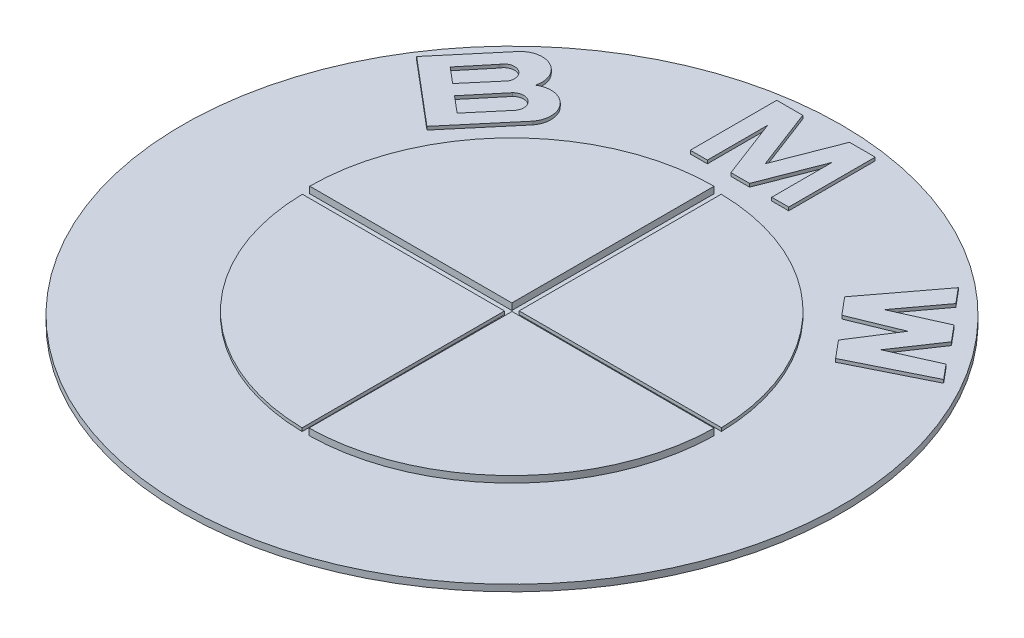
from build123d import *

# Parameters (mm, degrees)
BOSS_EXTRUDE7_DEPTH   = 4
BOSS_EXTRUDE7_2_DEPTH = 4
SKETCH2_R             = 201.031521777
BOSS_EXTRUDE7_3_DEPTH = 4
BOSS_EXTRUDE10_DEPTH  = 6
BOSS_EXTRUDE11_DEPTH  = 8


with BuildPart() as part:
    # Sketch2 → Boss-Extrude7 (new body)
    with BuildSketch(Plane(origin=(0, 0, 0), x_dir=(1, 0, 0), z_dir=(0, 1, 0))):
        with BuildLine():
            Line((-105.724699903, 89.663383086), (-119.246794828, 73.282274115))
            Line((-119.246794828, 73.282274115), (-109.765335501, 65.257065635))
            Line((-109.765335501, 65.257065635), (-94.158059223, 83.696431494))
            ThreePointArc((-94.158059223, 83.696431494), (-96.957903767, 92.46322763), (-105.724699903, 89.663383086))
        make_face()
    extrude(amount=BOSS_EXTRUDE7_DEPTH)



with BuildPart() as body_2:
    # Sketch2 → Boss-Extrude7 2 (new body)
    with BuildSketch(Plane(origin=(0, 0, 0), x_dir=(1, 0, 0), z_dir=(0, 1, 0))):
        with BuildLine():
            Line((-86.720953962, 78.679511972), (-102.73694564, 59.398841753))
            Line((-102.73694564, 59.398841753), (-92.743706606, 50.992764213))
            Line((-92.743706606, 50.992764213), (-76.304147471, 70.536296052))
            ThreePointArc((-76.304147471, 70.536296052), (-77.810994424, 79.342936952), (-86.720953962, 78.679511972))
        make_face()
    extrude(amount=BOSS_EXTRUDE7_2_DEPTH)


with BuildPart() as body_3:
    # Sketch2 → Boss-Extrude7 3 (new body)
    with BuildSketch(Plane(origin=(0, 0, 0), x_dir=(1, 0, 0), z_dir=(0, 1, 0))):
        with Locations((28.728301923, -36.999075156)):
            Circle(SKETCH2_R)
        with BuildLine():
            Line((26.186120795, -39.0255328), (26.186120795, -162.512993196))
            ThreePointArc((26.186120795, -162.512993196), (-60.428579099, -125.690271204), (-97.133377287, -39.0255328))
            Line((-97.133377287, -39.0255328), (26.186120795, -39.0255328))
        make_face(mode=Mode.SUBTRACT)
        with BuildLine():
            ThreePointArc((154.049264899, -39.0255328), (117.2962644, -125.8779667), (30.394002326, -162.512993196))
            Line((30.394002326, -162.512993196), (30.778576004, -39.0255328))
            Line((30.778576004, -39.0255328), (154.049264899, -39.0255328))
        make_face(mode=Mode.SUBTRACT)
        with BuildLine():
            Line((26.186120795, -34.547580598), (-97.133377287, -34.521676642))
            ThreePointArc((-97.133377287, -34.521676642), (-60.995615689, 52.670789611), (26.21202475, 88.771917484))
            Line((26.21202475, 88.771917484), (26.186120795, -34.547580598))
        make_face(mode=Mode.SUBTRACT)
        with BuildLine():
            Line((-94.990225375, 34.841498226), (-135.009946729, 68.585928646))
            Line((-135.009946729, 68.585928646), (-106.417778138, 102.547819155))
            ThreePointArc((-106.417778138, 102.547819155), (-90.003173195, 105.01895685), (-83.698244067, 89.663383086))
            ThreePointArc((-83.698244067, 89.663383086), (-66.285464204, 87.446031309), (-65.417157073, 69.914129125))
            Line((-65.417157073, 69.914129125), (-94.990225375, 34.841498226))
        make_face(mode=Mode.SUBTRACT)
        Polygon((8.355015654, 102.547819155), (-2.065397597, 102.547819155), (-2.065397597, 155.293154737), (13.798357886, 155.293154737), (27.918843536, 118.248670779), (42.300819661, 155.293154737), (57.990248161, 155.293154737), (57.990248161, 102.547819155), (47.617792653, 102.547819155), (47.617792653, 139.342235762), (33.550995269, 103.109575833), (22.166053086, 103.109575833), (8.355015654, 139.342235762), align=None, mode=Mode.SUBTRACT)
        with BuildLine():
            ThreePointArc((30.605293957, 88.771917484), (117.203738276, 52.031920201), (154.049264899, -34.521676642))
            Line((154.049264899, -34.521676642), (30.605293957, -34.521676642))
            Line((30.605293957, -34.521676642), (30.605293957, 88.771917484))
        make_face(mode=Mode.SUBTRACT)
        Polygon((131.33927946, 61.588463956), (122.465283041, 72.187959679), (152.283015919, 111.685620156), (159.93326792, 102.547819155), (141.369313955, 77.507315286), (170.710153416, 90.644495422), (178.795417003, 80.987097248), (161.511800701, 55.272594698), (188.932474766, 67.550032606), (196.33706913, 58.705656004), (152.283015919, 36.866764734), (143.417774586, 47.455802993), (159.93326792, 73.282274115), align=None, mode=Mode.SUBTRACT)
    extrude(amount=BOSS_EXTRUDE7_3_DEPTH)


with BuildPart() as part_1:
    add(part.part)

    add(body_2.part)  # Boss-Extrude10 merges body 2

    add(body_3.part)  # Boss-Extrude10 merges body 3
    # Sketch2<12> → Boss-Extrude10 (add)
    # profile 1 of 5: a face of its own
    with BuildSketch(Plane(origin=(0, 0, 0), x_dir=(1, 0, 0), z_dir=(0, 1, 0))):
        with BuildLine():
            Line((30.605293957, -34.521676642), (154.049264899, -34.521676642))
            ThreePointArc((154.049264899, -34.521676642), (117.203738276, 52.031920201), (30.605293957, 88.771917484))
            Line((30.605293957, 88.771917484), (30.605293957, -34.521676642))
        make_face()
    # profile 2 of 5: a face of its own
    with BuildSketch(Plane(origin=(0, 0, 0), x_dir=(1, 0, 0), z_dir=(0, 1, 0))):
        with BuildLine():
            ThreePointArc((-97.133377287, -39.0255328), (-60.428579099, -125.690271204), (26.186120795, -162.512993196))
            Line((26.186120795, -162.512993196), (26.186120795, -39.0255328))
            Line((26.186120795, -39.0255328), (-97.133377287, -39.0255328))
        make_face()
    # profile 3 of 5: a face of its own
    with BuildSketch(Plane(origin=(0, 0, 0), x_dir=(1, 0, 0), z_dir=(0, 1, 0))):
        with BuildLine():
            Line((-106.417778138, 102.547819155), (-135.009946729, 68.585928646))
            Line((-135.009946729, 68.585928646), (-94.990225375, 34.841498226))
            Line((-94.990225375, 34.841498226), (-65.417157073, 69.914129125))
            ThreePointArc((-65.417157073, 69.914129125), (-66.285464204, 87.446031309), (-83.698244067, 89.663383086))
            ThreePointArc((-83.698244067, 89.663383086), (-90.003173195, 105.01895685), (-106.417778138, 102.547819155))
        make_face()
        with BuildLine():
            Line((-109.765335501, 65.257065635), (-119.246794828, 73.282274115))
            Line((-119.246794828, 73.282274115), (-105.724699903, 89.663383086))
            ThreePointArc((-105.724699903, 89.663383086), (-96.957903767, 92.46322763), (-94.158059223, 83.696431494))
            Line((-94.158059223, 83.696431494), (-109.765335501, 65.257065635))
        make_face(mode=Mode.SUBTRACT)
        with BuildLine():
            Line((-92.743706606, 50.992764213), (-102.73694564, 59.398841753))
            Line((-102.73694564, 59.398841753), (-86.720953962, 78.679511972))
            ThreePointArc((-86.720953962, 78.679511972), (-77.810994424, 79.342936952), (-76.304147471, 70.536296052))
            Line((-76.304147471, 70.536296052), (-92.743706606, 50.992764213))
        make_face(mode=Mode.SUBTRACT)
    # profile 4 of 5: a face of its own
    with BuildSketch(Plane(origin=(0, 0, 0), x_dir=(1, 0, 0), z_dir=(0, 1, 0))):
        Polygon((-2.065397597, 155.293154737), (-2.065397597, 102.547819155), (8.355015654, 102.547819155), (8.355015654, 139.342235762), (22.166053086, 103.109575833), (33.550995269, 103.109575833), (47.617792653, 139.342235762), (47.617792653, 102.547819155), (57.990248161, 102.547819155), (57.990248161, 155.293154737), (42.300819661, 155.293154737), (27.918843536, 118.248670779), (13.798357886, 155.293154737), align=None)
    # profile 5 of 5: a face of its own
    with BuildSketch(Plane(origin=(0, 0, 0), x_dir=(1, 0, 0), z_dir=(0, 1, 0))):
        Polygon((152.283015919, 111.685620156), (122.465283041, 72.187959679), (131.33927946, 61.588463956), (159.93326792, 73.282274115), (143.417774586, 47.455802993), (152.283015919, 36.866764734), (196.33706913, 58.705656004), (188.932474766, 67.550032606), (161.511800701, 55.272594698), (178.795417003, 80.987097248), (170.710153416, 90.644495422), (141.369313955, 77.507315286), (159.93326792, 102.547819155), align=None)
    extrude(amount=BOSS_EXTRUDE10_DEPTH)

    # Sketch2<13> → Boss-Extrude11 (add)
    with BuildSketch(Plane(origin=(0, 0, 0), x_dir=(1, 0, 0), z_dir=(0, 1, 0))):
        with BuildLine():
            Line((30.778576004, -39.0255328), (30.394002326, -162.512993196))
            ThreePointArc((30.394002326, -162.512993196), (117.2962644, -125.8779667), (154.049264899, -39.0255328))
            Line((154.049264899, -39.0255328), (30.778576004, -39.0255328))
        make_face()
        with BuildLine():
            ThreePointArc((26.21202475, 88.771917484), (-60.995615689, 52.670789611), (-97.133377287, -34.521676642))
            Line((-97.133377287, -34.521676642), (26.186120795, -34.547580598))
            Line((26.186120795, -34.547580598), (26.21202475, 88.771917484))
        make_face()
    extrude(amount=BOSS_EXTRUDE11_DEPTH)


solid = part_1.part
